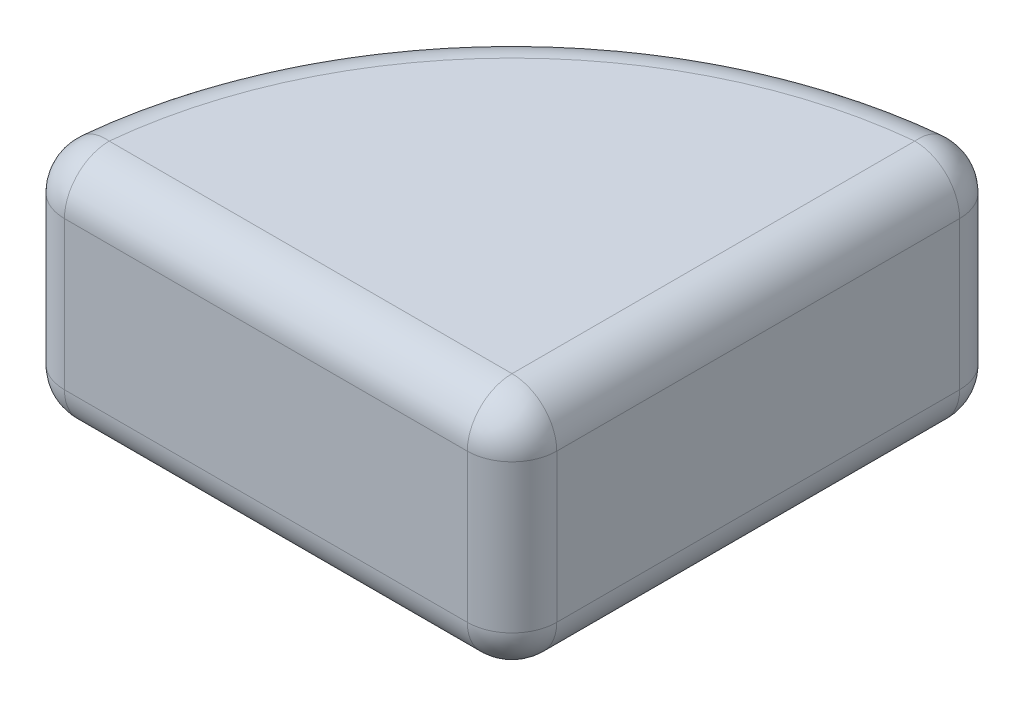
from build123d import *

# Parameters (mm, degrees)
BOSS_EXTRUDE1_DEPTH = 159.4
FILLET1_R           = 30


with BuildPart() as part:
    # Sketch1 → Boss-Extrude1 (new body)
    with BuildSketch(Plane(origin=(0, 0, 0), x_dir=(1, 0, 0), z_dir=(0, 1, 0))):
        with BuildLine():
            Line((-331.6, 0), (0, 0))
            Line((0, 0), (0, 331.6))
            ThreePointArc((0, 331.6), (-234.476608641, 234.476608641), (-331.6, 0))
        make_face()
    extrude(amount=BOSS_EXTRUDE1_DEPTH)

    # Fillet1
    fillet1_edges = [part.edges().sort_by_distance(p)[0] for p in [
        (-165.8, 159.4, 0),
        (-165.8, 0, 0),
        (-234.476608641, 0, -234.476608641),
        (0, 0, -165.8),
        (0, 159.4, -165.8),
        (0, 79.7, 0),
        (-331.6, 79.7, 0),
        (0, 79.7, -331.6),
        (-234.476608641, 159.4, -234.476608641),
    ]]
    fillet(fillet1_edges, radius=FILLET1_R)


solid = part.part
